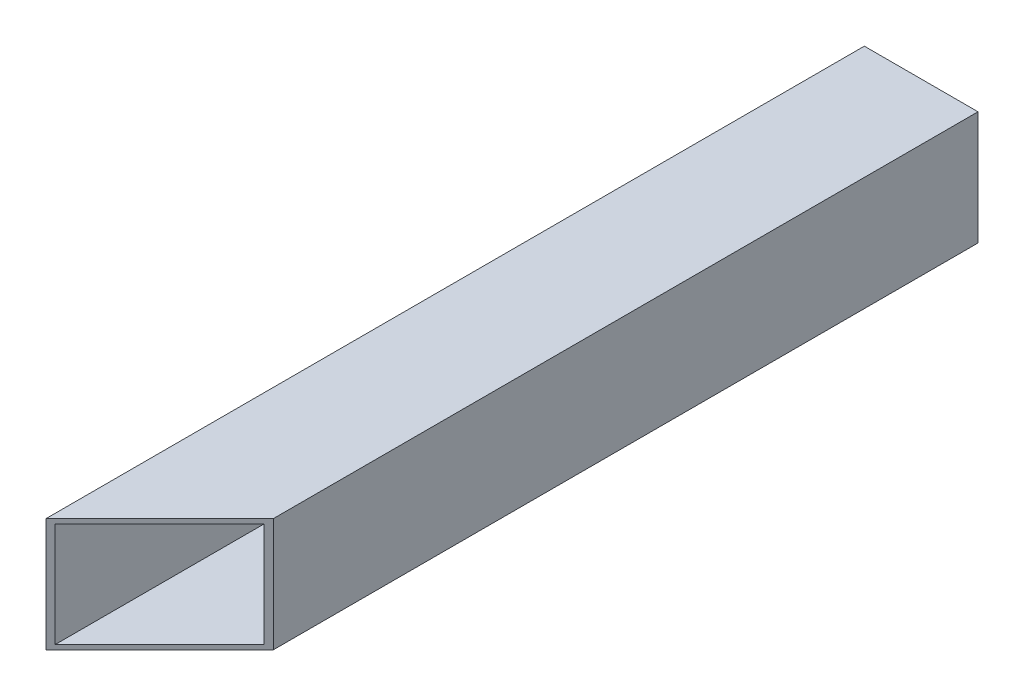
from build123d import *

# Parameters (mm, degrees)
SKETCH2_W           = 25
SKETCH2_H           = 25
SKETCH2_W_2         = 23
SKETCH2_H_2         = 23
BOSS_EXTRUDE1_DEPTH = 180
CUT_EXTRUDE1_DEPTH  = 210


with BuildPart() as part:
    # Sketch2 → Boss-Extrude1 (new body)
    with BuildSketch(Plane.XY):
        Rectangle(SKETCH2_W, SKETCH2_H)
        Rectangle(SKETCH2_W_2, SKETCH2_H_2, mode=Mode.SUBTRACT)
    extrude(amount=BOSS_EXTRUDE1_DEPTH)

    # Sketch3 → Cut-Extrude1 (cut)
    with BuildSketch(Plane(origin=(0, 12.5, 0), x_dir=(1, 0, 0), z_dir=(0, 1, 0))):
        Polygon((12.5, -180), (12.5, -155), (-12.5, -180), align=None)
    extrude(amount=-CUT_EXTRUDE1_DEPTH, mode=Mode.SUBTRACT)


solid = part.part
